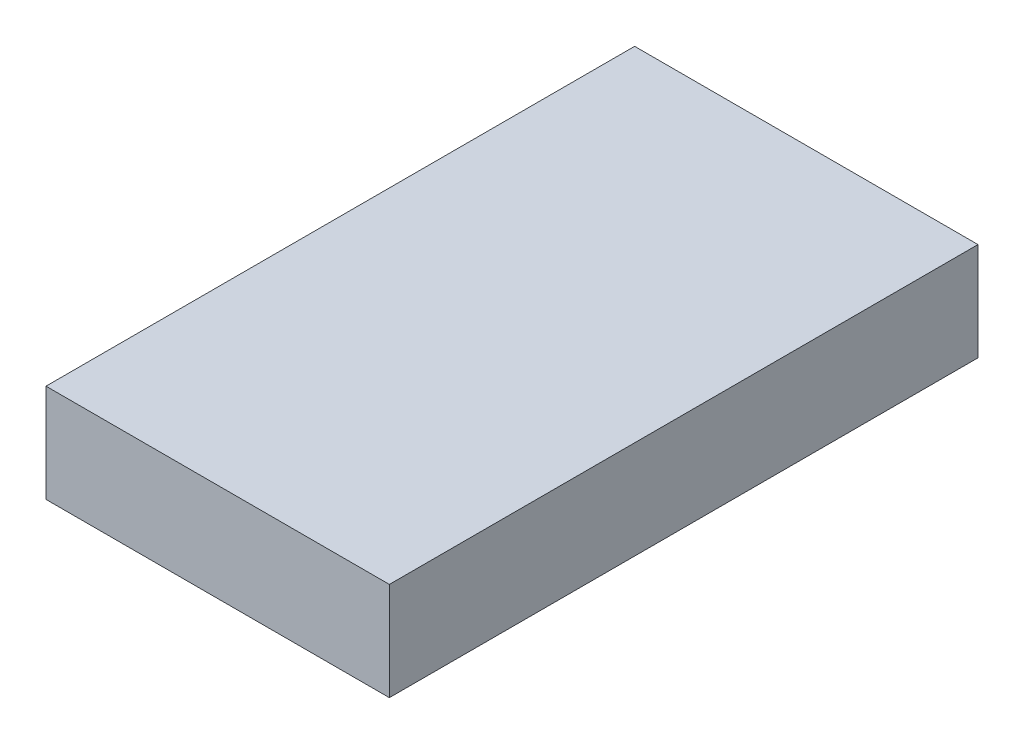
from build123d import *

# Parameters (mm, degrees)
SKETCH_1_W      = 7
SKETCH_1_H      = 12
EXTRUDE_1_DEPTH = 2


with BuildPart() as part:
    # 草图1 → 凸台-拉伸1 (new body)
    with BuildSketch(Plane(origin=(0, 0, 0), x_dir=(1, 0, 0), z_dir=(0, 1, 0))):
        with Locations((3.5, 6)):
            Rectangle(SKETCH_1_W, SKETCH_1_H)
    extrude(amount=EXTRUDE_1_DEPTH)


solid = part.part
